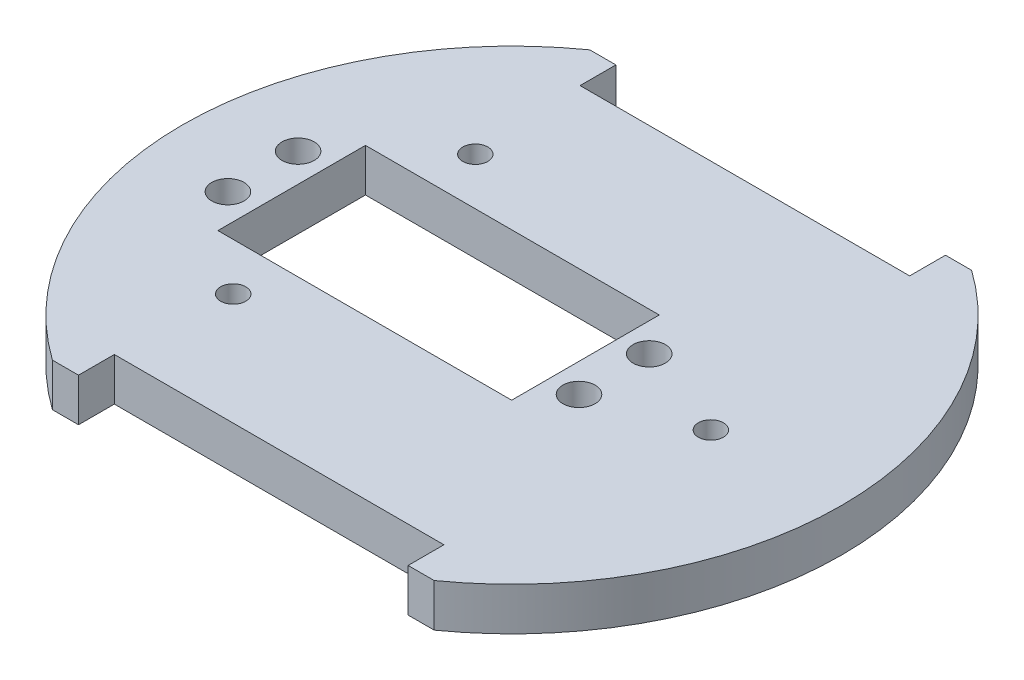
from build123d import *

# Parameters (mm, degrees)
SKETCH1_R           = 2.25
SKETCH1_R_2         = 1.75
SKETCH1_W           = 41
SKETCH1_H           = 20.6
BOSS_EXTRUDE1_DEPTH = 6


with BuildPart() as part:
    # Sketch1 → Boss-Extrude1 (new body)
    with BuildSketch(Plane(origin=(0, 0, 0), x_dir=(1, 0, 0), z_dir=(0, 1, 0))):
        with BuildLine():
            Line((-26.64113361, 37.5), (-23, 37.5))
            Line((-23, 37.5), (-23, 32.5))
            Line((-23, 32.5), (23, 32.5))
            Line((23, 32.5), (23, 37.5))
            Line((23, 37.5), (26.64113361, 37.5))
            ThreePointArc((26.64113361, 37.5), (46, 0), (26.64113361, -37.5))
            Line((26.64113361, -37.5), (23, -37.5))
            Line((23, -37.5), (23, -32.5))
            Line((23, -32.5), (-23, -32.5))
            Line((-23, -32.5), (-23, -37.5))
            Line((-23, -37.5), (-26.64113361, -37.5))
            ThreePointArc((-26.64113361, -37.5), (-46, 0), (-26.64113361, 37.5))
        make_face()
        with Locations(Location((14.25, 4.9, 0), (0, 0, 270))):
            Circle(SKETCH1_R, mode=Mode.SUBTRACT)
        with Locations(Location((14.25, -4.9, 0), (0, 0, 270))):
            Circle(SKETCH1_R, mode=Mode.SUBTRACT)
        with Locations(Location((-34.75, 4.9, 0), (0, 0, 90))):
            Circle(SKETCH1_R, mode=Mode.SUBTRACT)
        with Locations(Location((-34.75, -4.9, 0), (0, 0, 90))):
            Circle(SKETCH1_R, mode=Mode.SUBTRACT)
        with Locations(Location((27.75, 0, 0), (0, 0, 270))):
            Circle(SKETCH1_R_2, mode=Mode.SUBTRACT)
        with Locations(Location((-22.015555193, 16.893129655, 0), (0, 0, 270))):
            Circle(SKETCH1_R_2, mode=Mode.SUBTRACT)
        with Locations(Location((-22.015555193, -16.893129655, 0), (0, 0, 270))):
            Circle(SKETCH1_R_2, mode=Mode.SUBTRACT)
        with Locations((-10.25, 0)):
            Rectangle(SKETCH1_W, SKETCH1_H, mode=Mode.SUBTRACT)
    extrude(amount=BOSS_EXTRUDE1_DEPTH)


solid = part.part
